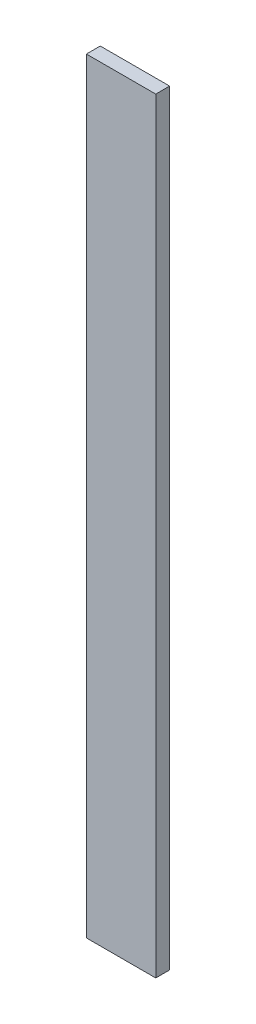
from build123d import *

# Parameters (mm, degrees)
SKETCH_1_W      = 15
SKETCH_1_H      = 165.5
EXTRUDE_1_DEPTH = 3


with BuildPart() as part:
    # Эскиз1 → Бобышка-Вытянуть1 (new body)
    with BuildSketch(Plane.XY):
        Rectangle(SKETCH_1_W, SKETCH_1_H)
    extrude(amount=EXTRUDE_1_DEPTH)


solid = part.part
